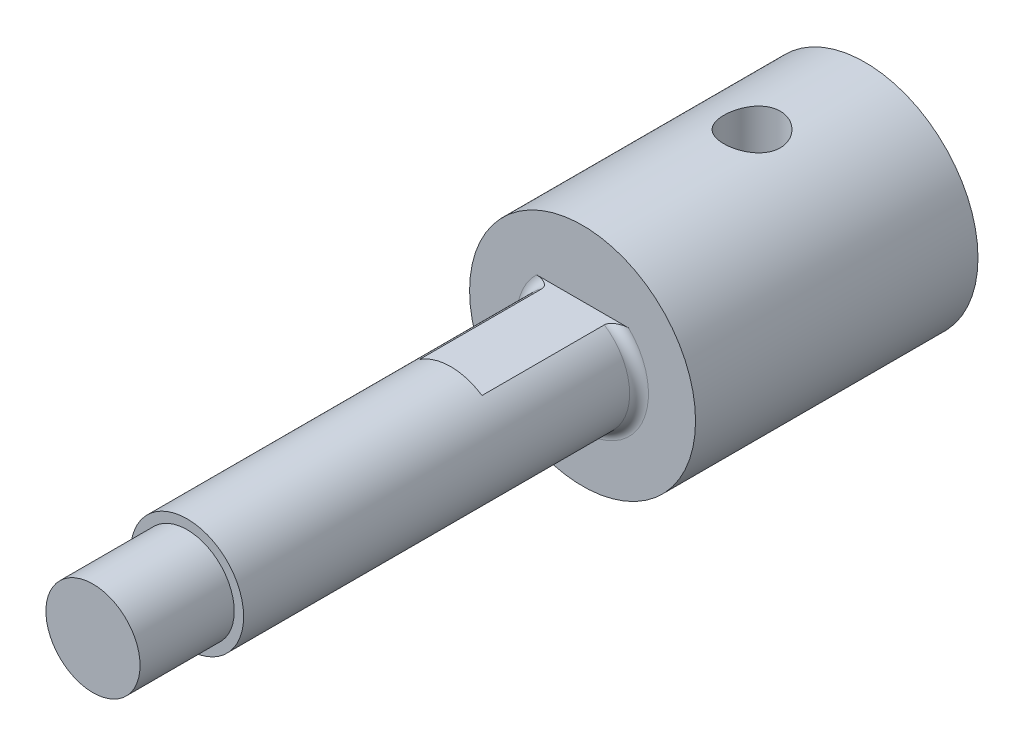
from build123d import *

# Parameters (mm, degrees)
SKETCH1_R           = 6
SKETCH1_R_2         = 3
BOSS_EXTRUDE1_DEPTH = 11
SKETCH2_R           = 1.5
CUT_EXTRUDE1_DEPTH  = 14.892443989
SKETCH3_R           = 6
BOSS_EXTRUDE2_DEPTH = 4
BOSS_EXTRUDE3_DEPTH = 7
SKETCH5_R           = 3
BOSS_EXTRUDE6_DEPTH = 14
SKETCH7_R           = 2.5
BOSS_EXTRUDE7_DEPTH = 5
FILLET1_R           = 0.5


with BuildPart() as part:
    # Sketch1 → Boss-Extrude1 (new body)
    with BuildSketch(Plane.XY):
        Circle(SKETCH1_R)
        Circle(SKETCH1_R_2, mode=Mode.SUBTRACT)
    extrude(amount=BOSS_EXTRUDE1_DEPTH)

    # Sketch2 → Cut-Extrude1 (cut, through all)
    with BuildSketch(Plane(origin=(0, 0, 0), x_dir=(1, 0, 0), z_dir=(0, 1, 0))):
        with Locations(Location((0, -6, 0), (0, 0, 90))):
            Circle(SKETCH2_R)
    extrude(amount=CUT_EXTRUDE1_DEPTH, mode=Mode.SUBTRACT)

    # Sketch3 → Boss-Extrude2 (add)
    with BuildSketch(Plane.XY.offset(11)):
        Circle(SKETCH3_R)
    extrude(amount=BOSS_EXTRUDE2_DEPTH)

    # Sketch4 → Boss-Extrude3 (add)
    with BuildSketch(Plane.XY.offset(15)):
        with BuildLine():
            Line((-1.658312395, 2.5), (1.658312395, 2.5))
            ThreePointArc((1.658312395, 2.5), (0, -3), (-1.658312395, 2.5))
        make_face()
    extrude(amount=BOSS_EXTRUDE3_DEPTH)

    # Sketch5 → Boss-Extrude6 (add)
    with BuildSketch(Plane.XY.offset(22)):
        Circle(SKETCH5_R)
    extrude(amount=BOSS_EXTRUDE6_DEPTH)

    # Sketch7 → Boss-Extrude7 (add)
    with BuildSketch(Plane.XY.offset(36)):
        Circle(SKETCH7_R)
    extrude(amount=BOSS_EXTRUDE7_DEPTH)

    # Fillet1
    fillet1_edges = [part.edges().sort_by_distance(p)[0] for p in [
        (0, -3, 15),
    ]]
    fillet(fillet1_edges, radius=FILLET1_R)


solid = part.part
